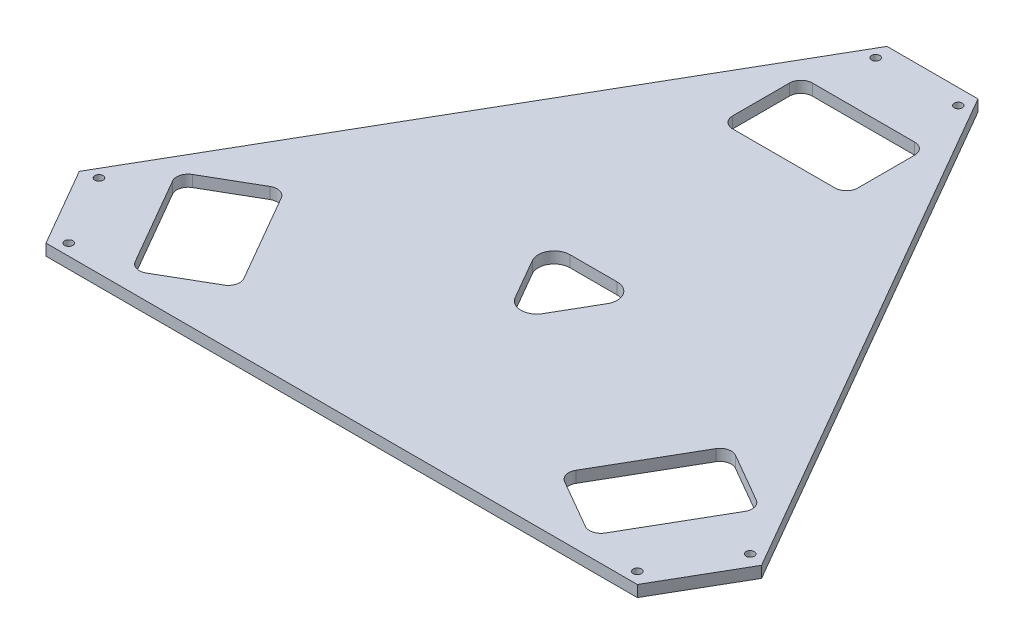
from build123d import *

# Parameters (mm, degrees)
BOSS_EXTRU_1_DEPTH      = 5
D_GAGEMENT_M31_D        = 3.6
ENL_V_MAT_EXTRU_2_DEPTH = 10


with BuildPart() as part:
    # Esquisse1 → Boss.-Extru.1 (new body)
    with BuildSketch(Plane(origin=(0, 0, 0), x_dir=(1, 0, 0), z_dir=(0, 1, 0))):
        Polygon((-20, -23.663326483), (-32.5, -45.313961578), (-137.5, -227.179296373), (-150, -248.829931467), (-130, -283.470947619), (-105, -283.470947619), (105, -283.470947619), (130, -283.470947619), (150, -248.829931467), (137.5, -227.179296373), (32.5, -45.313961578), (20, -23.663326483), align=None)
        with BuildLine():
            ThreePointArc((-96.494247139, -272.786646223), (-100.288342364, -273.286148335), (-103.324374158, -270.956519204))
            Line((-103.324374158, -270.956519204), (-125.824374158, -231.985376033))
            ThreePointArc((-125.824374158, -231.985376033), (-126.32387627, -228.191280808), (-123.994247139, -225.155249015))
            Line((-123.994247139, -225.155249015), (-102.343612044, -212.655249015))
            ThreePointArc((-102.343612044, -212.655249015), (-98.549516819, -212.155746902), (-95.513485025, -214.485376033))
            Line((-95.513485025, -214.485376033), (-73.013485025, -253.456519204))
            ThreePointArc((-73.013485025, -253.456519204), (-72.513982913, -257.250614429), (-74.843612044, -260.286646223))
            Line((-74.843612044, -260.286646223), (-96.494247139, -272.786646223))
        make_face(mode=Mode.SUBTRACT)
        with BuildLine():
            ThreePointArc((74.843612044, -260.286646223), (72.513982913, -257.250614429), (73.013485025, -253.456519204))
            Line((73.013485025, -253.456519204), (95.513485025, -214.485376033))
            ThreePointArc((95.513485025, -214.485376033), (98.549516819, -212.155746902), (102.343612044, -212.655249015))
            Line((102.343612044, -212.655249015), (123.994247139, -225.155249015))
            ThreePointArc((123.994247139, -225.155249015), (126.32387627, -228.191280808), (125.824374158, -231.985376033))
            Line((125.824374158, -231.985376033), (103.324374158, -270.956519204))
            ThreePointArc((103.324374158, -270.956519204), (100.288342364, -273.286148335), (96.494247139, -272.786646223))
            Line((96.494247139, -272.786646223), (74.843612044, -260.286646223))
        make_face(mode=Mode.SUBTRACT)
        with BuildLine():
            Line((22.5, -89.022310332), (-22.5, -89.022310332))
            ThreePointArc((-22.5, -89.022310332), (-26.035533906, -87.557844238), (-27.5, -84.022310332))
            Line((-27.5, -84.022310332), (-27.5, -59.022310332))
            ThreePointArc((-27.5, -59.022310332), (-26.035533906, -55.486776426), (-22.5, -54.022310332))
            Line((-22.5, -54.022310332), (22.5, -54.022310332))
            ThreePointArc((22.5, -54.022310332), (26.035533906, -55.486776426), (27.5, -59.022310332))
            Line((27.5, -59.022310332), (27.5, -84.022310332))
            ThreePointArc((27.5, -84.022310332), (26.035533906, -87.557844238), (22.5, -89.022310332))
        make_face(mode=Mode.SUBTRACT)
    extrude(amount=BOSS_EXTRU_1_DEPTH)

    # Dégagement M31 (through all)
    with Locations(Plane(origin=(-143.169872981, 5, 246.999804448), x_dir=(0, 0, 1), z_dir=(0, 1, 0))):
        with Locations((0, 0), (31.471143171, 18.169872981), (31.471143171, 268.169872981), (0, 286.339745962), (-216.506350946, 125), (-216.506350946, 161.339745962)):
            Hole(D_GAGEMENT_M31_D / 2)

    # Esquisse6 → Enlèv. mat.-Extru.2 (cut)
    with BuildSketch(Plane(origin=(0, 0, 0), x_dir=(-1, 0, 0), z_dir=(0, -1, 0))):
        with BuildLine():
            Line((-16.437822174, -183.172945427), (-6.062177826, -201.144088597))
            ThreePointArc((-6.062177826, -201.144088597), (0, -204.644088597), (6.062177826, -201.144088597))
            Line((6.062177826, -201.144088597), (16.437822174, -183.172945427))
            ThreePointArc((16.437822174, -183.172945427), (16.437822174, -176.172945427), (10.375644347, -172.672945427))
            Line((10.375644347, -172.672945427), (-10.375644347, -172.672945427))
            ThreePointArc((-10.375644347, -172.672945427), (-16.437822174, -176.172945427), (-16.437822174, -183.172945427))
        make_face()
    extrude(amount=-ENL_V_MAT_EXTRU_2_DEPTH, mode=Mode.SUBTRACT)


solid = part.part
